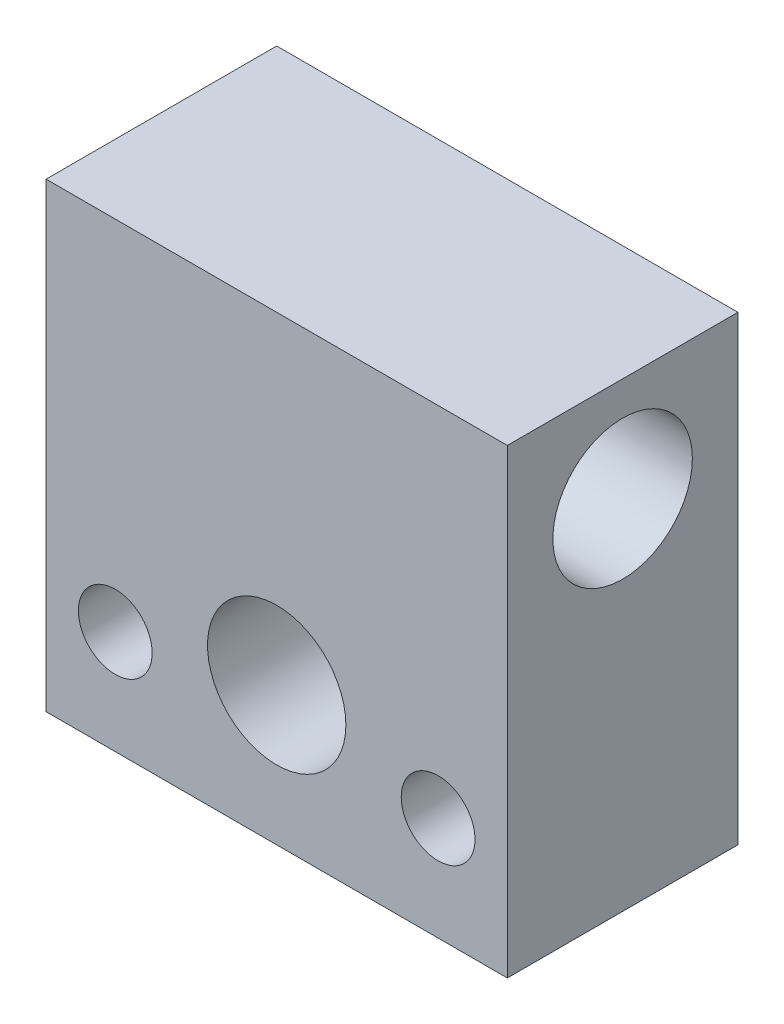
from build123d import *

# Parameters (mm, degrees)
CROQUIS1_W                         = 20
CROQUIS1_H                         = 20
SALIENTE_EXTRUIR1_DEPTH            = 10
DI_METRO_DE_TALADRO_6_0_6_1_D      = 6
DI_METRO_DE_TALADRO_3_2_3_2_1_D    = 3.2
DI_METRO_DE_TALADRO_3_0_3_1_D      = 3
DI_METRO_DE_TALADRO_3_0_3_1_DEPTH  = 4
DI_METRO_DE_TALADRO_2_0_2_1_D      = 2
DI_METRO_DE_TALADRO_2_0_2_1_DEPTH  = 5
TALADRO1_D                         = 6.05
DI_METRO_DE_TALADRO_3_0_3_2_REACH  = 19.321
DI_METRO_DE_TALADRO_3_0_3_2_BORE_R = 1.5
CHAFL_N1_SIZE                      = 1.2


with BuildPart() as part:
    # Croquis1 → Saliente-Extruir1 (new body)
    with BuildSketch(Plane(origin=(0, 0, 0), x_dir=(-1, 0, 0), z_dir=(0, 0, -1))):
        Rectangle(CROQUIS1_W, CROQUIS1_H)
    extrude(amount=-SALIENTE_EXTRUIR1_DEPTH)

    # Diámetro de taladro Ø6.0 (6)1 (through all)
    with Locations(Plane.XY.offset(10)):
        with Locations((0, -4)):
            Hole(DI_METRO_DE_TALADRO_6_0_6_1_D / 2)

    # Diámetro de taladro Ø3.2 (3.2)1 (through all)
    with Locations(Plane(origin=(0, 0, 0), x_dir=(-1, 0, 0), z_dir=(0, 0, -1))):
        with Locations((7, -5.5), (-7, -5.5)):
            Hole(DI_METRO_DE_TALADRO_3_2_3_2_1_D / 2)

    # Diámetro de taladro Ø3.0 (3)1
    with Locations(Plane.ZY.offset(10)):
        with Locations((5.5, -1.5)):
            Hole(DI_METRO_DE_TALADRO_3_0_3_1_D / 2, depth=DI_METRO_DE_TALADRO_3_0_3_1_DEPTH)

    # Diámetro de taladro Ø2.0 (2)1
    with Locations(Plane.ZY.offset(10)):
        with Locations((2, -1.5)):
            Hole(DI_METRO_DE_TALADRO_2_0_2_1_D / 2, depth=DI_METRO_DE_TALADRO_2_0_2_1_DEPTH)

    # Taladro1 (through all)
    with Locations(Plane(origin=(10, 0, 0), x_dir=(0, 0, -1), z_dir=(1, 0, 0))):
        with Locations((-5, 5.5)):
            Hole(TALADRO1_D / 2)

    # Diámetro de taladro Ø3.0 (3)2 bore → Diámetro de taladro Ø3.0 (3)2 (cut, up to next)
    with BuildSketch(Plane(origin=(0, 0, 0), x_dir=(-1, 0, 0), z_dir=(0, 0, -1)), mode=Mode.PRIVATE) as di_metro_de_taladro_3_0_3_2_sk1:
        with Locations((0, 5.5)):
            Circle(DI_METRO_DE_TALADRO_3_0_3_2_BORE_R)
    di_metro_de_taladro_3_0_3_2_tool1 = extrude(di_metro_de_taladro_3_0_3_2_sk1.sketch, amount=-DI_METRO_DE_TALADRO_3_0_3_2_REACH, mode=Mode.PRIVATE) & part.part
    add(di_metro_de_taladro_3_0_3_2_tool1.solids().sort_by_distance((0, 5.5, 0))[0], mode=Mode.SUBTRACT)

    # Chaflán1
    chafl_n1_edges = [part.edges().sort_by_distance(p)[0] for p in [
        (5.4, -5.5, 0),
        (-8.6, -5.5, 0),
    ]]
    chamfer(chafl_n1_edges, length=CHAFL_N1_SIZE)


solid = part.part
